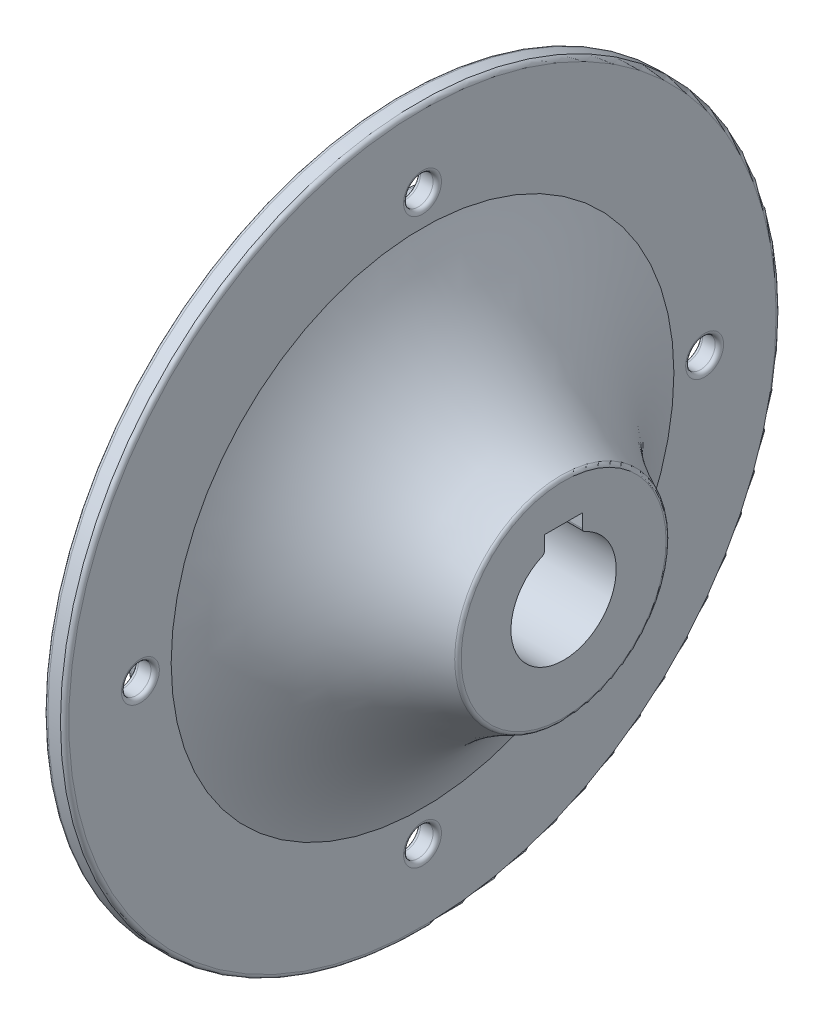
from build123d import *

# Parameters (mm, degrees)
SKETCH1_W           = 2.5
SKETCH1_H           = 12.65
BOSS_EXTRUDE1_DEPTH = 14
SKETCH4_R           = 1.75
CUT_EXTRUDE1_DEPTH  = 63.394410807
CUT_EXTRUDE2_DEPTH  = 23.25
SKETCH6_R           = 2.25
CUT_EXTRUDE3_DEPTH  = 65.44425886
FILLET1_R           = 0.5


with BuildPart() as part:
    # Sketch1 → Revolve1 (revolve)
    with BuildSketch(Plane.XY, mode=Mode.PRIVATE) as revolve1_sk:
        with BuildLine():
            Line((0, 12.65), (0, 0))
            Line((0, 0), (19.25, 0))
            Line((19.25, 0), (19.25, 12.5))
            ThreePointArc((19.25, 12.5), (9.076407039, 19.438606219), (2.5, 29.85))
            Line((2.5, 29.85), (0, 29.85))
            Line((0, 29.85), (-3, 29.85))
            Line((-3, 29.85), (-3, 12.65))
            Line((-3, 12.65), (0, 12.65))
        make_face()
        with Locations((1.25, 36.175)):
            Rectangle(SKETCH1_W, SKETCH1_H)
    revolve(revolve1_sk.sketch.rotate(Axis((-75.117650177, 0, 0), (1, 0, 0)), 90), axis=Axis((-75.117650177, 0, 0), (1, 0, 0)))

    # Sketch3 → Boss-Extrude1 (add)
    with BuildSketch(Plane.ZY):
        with BuildLine():
            Line((-2.4, 8.8), (-2.4, 6.469157596))
            ThreePointArc((-2.4, 6.469157596), (0, 6.9), (2.4, 6.469157596))
            Line((2.4, 6.469157596), (2.4, 8.8))
            Line((2.4, 8.8), (-2.4, 8.8))
        make_face()
        with BuildLine():
            Line((-2.4, 6.469157596), (-2.4, 0))
            Line((-2.4, 0), (2.4, 0))
            Line((2.4, 0), (2.4, 6.469157596))
            ThreePointArc((2.4, 6.469157596), (0, 6.9), (-2.4, 6.469157596))
        make_face()
        with BuildLine():
            Line((2.4, 0), (-2.4, 0))
            Line((-2.4, 0), (-2.4, 6.469157596))
            ThreePointArc((-2.4, 6.469157596), (-3.940177661, -5.664362277), (6.9, 0))
            ThreePointArc((6.9, 0), (5.664362277, 3.940177661), (2.4, 6.469157596))
            Line((2.4, 6.469157596), (2.4, 0))
        make_face()
    extrude(amount=BOSS_EXTRUDE1_DEPTH)

    # Sketch4 → Cut-Extrude1 (cut, through all)
    with BuildSketch(Plane(origin=(2.5, 0, 0), x_dir=(0, 0, -1), z_dir=(1, 0, 0))):
        with Locations((0, 33.5)):
            Circle(SKETCH4_R)
        with Locations((33.5, 0)):
            Circle(SKETCH4_R)
        with Locations((0, -33.5)):
            Circle(SKETCH4_R)
        with Locations((-33.5, 0)):
            Circle(SKETCH4_R)
    extrude(amount=-CUT_EXTRUDE1_DEPTH, mode=Mode.SUBTRACT)

    # Sketch5 → Cut-Extrude2 (cut)
    with BuildSketch(Plane(origin=(19.25, 0, 0), x_dir=(0, 0, -1), z_dir=(1, 0, 0))):
        with BuildLine():
            Line((2.25, 7.8), (-2.25, 7.8))
            Line((-2.25, 7.8), (-2.25, 5.830951895))
            ThreePointArc((-2.25, 5.830951895), (0, 6.25), (2.25, 5.830951895))
            Line((2.25, 5.830951895), (2.25, 7.8))
        make_face()
        with BuildLine():
            ThreePointArc((2.25, 5.830951895), (0, 6.25), (-2.25, 5.830951895))
            Line((-2.25, 5.830951895), (-2.25, 0))
            Line((-2.25, 0), (2.25, 0))
            Line((2.25, 0), (2.25, 5.830951895))
        make_face()
        with BuildLine():
            Line((-2.25, 0), (-2.25, 5.830951895))
            ThreePointArc((-2.25, 5.830951895), (-3.535533906, -5.153882032), (6.25, 0))
            ThreePointArc((6.25, 0), (5.153882032, 3.535533906), (2.25, 5.830951895))
            Line((2.25, 5.830951895), (2.25, 0))
            Line((2.25, 0), (-2.25, 0))
        make_face()
    extrude(amount=-CUT_EXTRUDE2_DEPTH, mode=Mode.SUBTRACT)

    # Sketch6 → Cut-Extrude3 (cut, through all)
    with BuildSketch(Plane(origin=(-4, 0, 0), x_dir=(0, 0, -1), z_dir=(1, 0, 0))):
        Circle(SKETCH6_R)
    extrude(amount=-CUT_EXTRUDE3_DEPTH, mode=Mode.SUBTRACT)

    # Fillet1
    fillet1_edges = [part.edges().sort_by_distance(p)[0] for p in [
        (-3, 0, -12.65),
        (-3, 0, -29.85),
        (0, 0, -42.5),
        (2.5, 0, -42.5),
        (19.25, 0, -12.5),
        (-14, 8.8, 0),
        (-7, 8.8, 2.4),
        (-14, 7.634578798, -2.4),
        (-7, 8.8, -2.4),
        (-14, -5.664362277, -3.940177661),
        (-14, 7.634578798, 2.4),
        (0, 33.5, 1.75),
        (2.5, 33.5, 1.75),
        (0, 0, -31.75),
        (2.5, 0, -31.75),
        (0, -33.5, 1.75),
        (2.5, -33.5, 1.75),
        (0, 0, 35.25),
        (2.5, 0, 35.25),
        (7.625, 5.830951895, 2.25),
        (7.625, 5.830951895, -2.25),
    ]]
    fillet(fillet1_edges, radius=FILLET1_R)


solid = part.part
